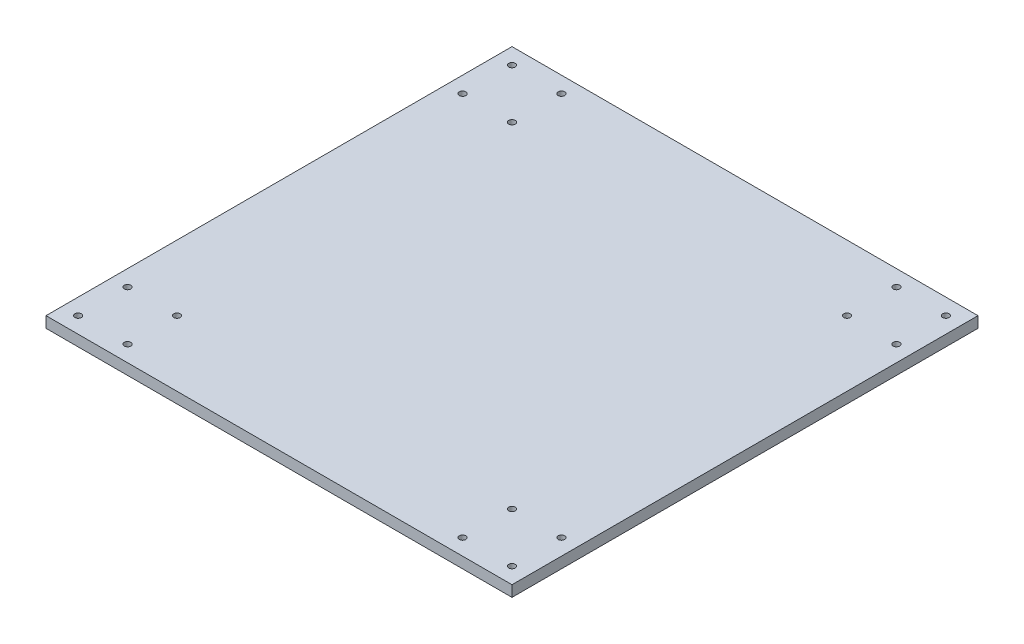
from build123d import *

# Parameters (mm, degrees)
SKETCH1_W           = 254
SKETCH1_H           = 254
SKETCH1_R           = 1.778
BOSS_EXTRUDE1_DEPTH = 5.9944


with BuildPart() as part:
    # Sketch1 → Boss-Extrude1 (new body)
    with BuildSketch(Plane(origin=(0, 0, 0), x_dir=(1, 0, 0), z_dir=(0, 1, 0))):
        Rectangle(SKETCH1_W, SKETCH1_H)
        with Locations(Location((-118.2497, -118.2497, 0), (0, 0, 90))):
            Circle(SKETCH1_R, mode=Mode.SUBTRACT)
        with Locations(Location((-91.3003, -118.2497, 0), (0, 0, 90))):
            Circle(SKETCH1_R, mode=Mode.SUBTRACT)
        with Locations(Location((-118.2497, -91.3003, 0), (0, 0, 90))):
            Circle(SKETCH1_R, mode=Mode.SUBTRACT)
        with Locations(Location((-91.3003, -91.3003, 0), (0, 0, 90))):
            Circle(SKETCH1_R, mode=Mode.SUBTRACT)
        with Locations(Location((91.3003, -118.2497, 0), (0, 0, 90))):
            Circle(SKETCH1_R, mode=Mode.SUBTRACT)
        with Locations(Location((118.2497, -118.2497, 0), (0, 0, 90))):
            Circle(SKETCH1_R, mode=Mode.SUBTRACT)
        with Locations(Location((91.3003, -91.3003, 0), (0, 0, 90))):
            Circle(SKETCH1_R, mode=Mode.SUBTRACT)
        with Locations(Location((118.2497, -91.3003, 0), (0, 0, 90))):
            Circle(SKETCH1_R, mode=Mode.SUBTRACT)
        with Locations(Location((91.3003, 91.3003, 0), (0, 0, 90))):
            Circle(SKETCH1_R, mode=Mode.SUBTRACT)
        with Locations(Location((118.2497, 91.3003, 0), (0, 0, 90))):
            Circle(SKETCH1_R, mode=Mode.SUBTRACT)
        with Locations(Location((91.3003, 118.2497, 0), (0, 0, 90))):
            Circle(SKETCH1_R, mode=Mode.SUBTRACT)
        with Locations(Location((118.2497, 118.2497, 0), (0, 0, 90))):
            Circle(SKETCH1_R, mode=Mode.SUBTRACT)
        with Locations(Location((-118.2497, 91.3003, 0), (0, 0, 90))):
            Circle(SKETCH1_R, mode=Mode.SUBTRACT)
        with Locations(Location((-91.3003, 91.3003, 0), (0, 0, 90))):
            Circle(SKETCH1_R, mode=Mode.SUBTRACT)
        with Locations(Location((-118.2497, 118.2497, 0), (0, 0, 90))):
            Circle(SKETCH1_R, mode=Mode.SUBTRACT)
        with Locations(Location((-91.3003, 118.2497, 0), (0, 0, 90))):
            Circle(SKETCH1_R, mode=Mode.SUBTRACT)
    extrude(amount=BOSS_EXTRUDE1_DEPTH)


solid = part.part
